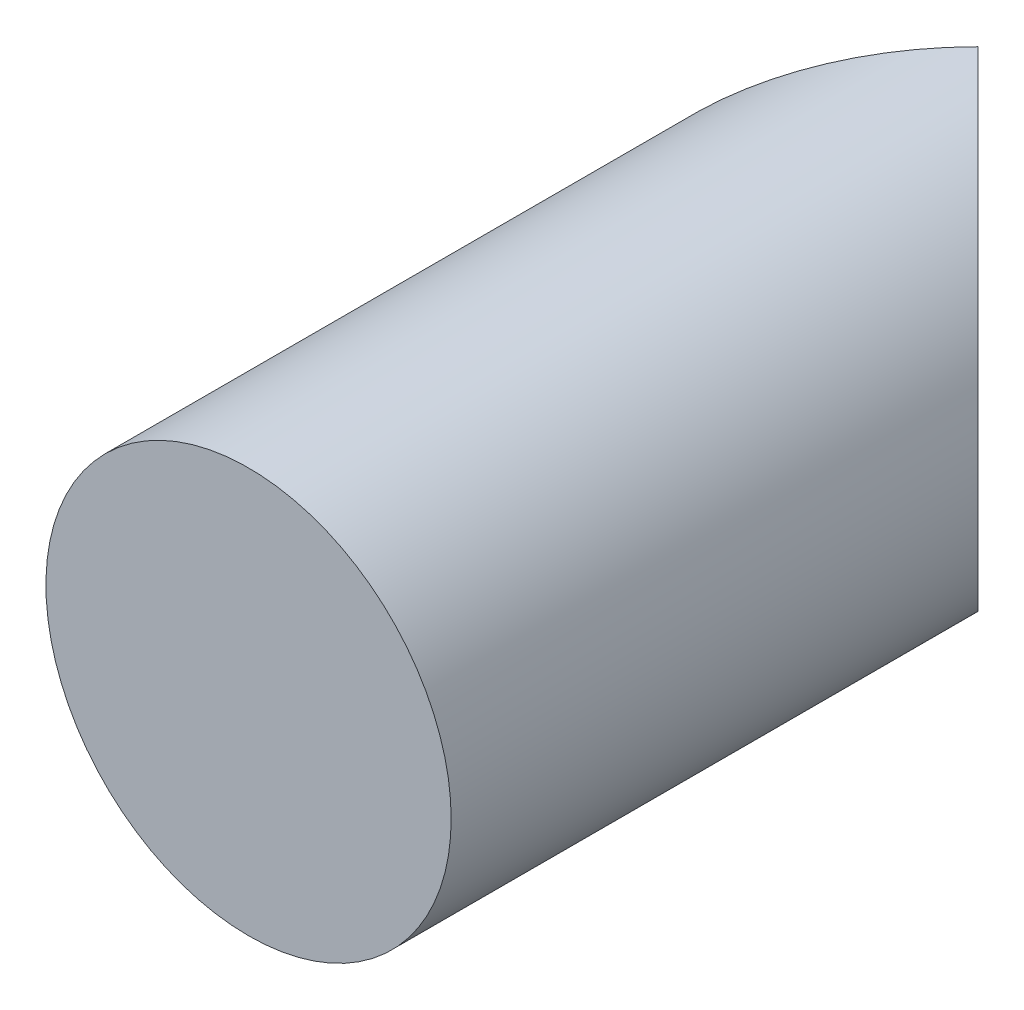
from build123d import *

# Parameters (mm, degrees)
SKETCH1_R           = 12.5
BOSS_EXTRUDE1_DEPTH = 45
CUT_EXTRUDE6_DEPTH  = 36


with BuildPart() as part:
    # Sketch1 → Boss-Extrude1 (new body)
    with BuildSketch(Plane.XY):
        with Locations(Location((0, 0, 0), (0, 0, 180))):
            Circle(SKETCH1_R)
    extrude(amount=BOSS_EXTRUDE1_DEPTH)

    # Sketch2 → Cut-Extrude6 (cut)
    with BuildSketch(Plane(origin=(0, -15.98711963, 0), x_dir=(-1, 0, 0), z_dir=(0, -1, 0))):
        Polygon((-12.5, -12.5), (0, 0), (-12.5, 0), align=None)
        Polygon((12.5, 0), (0, 0), (12.5, -12.5), align=None)
    extrude(amount=-CUT_EXTRUDE6_DEPTH, mode=Mode.SUBTRACT)


solid = part.part
